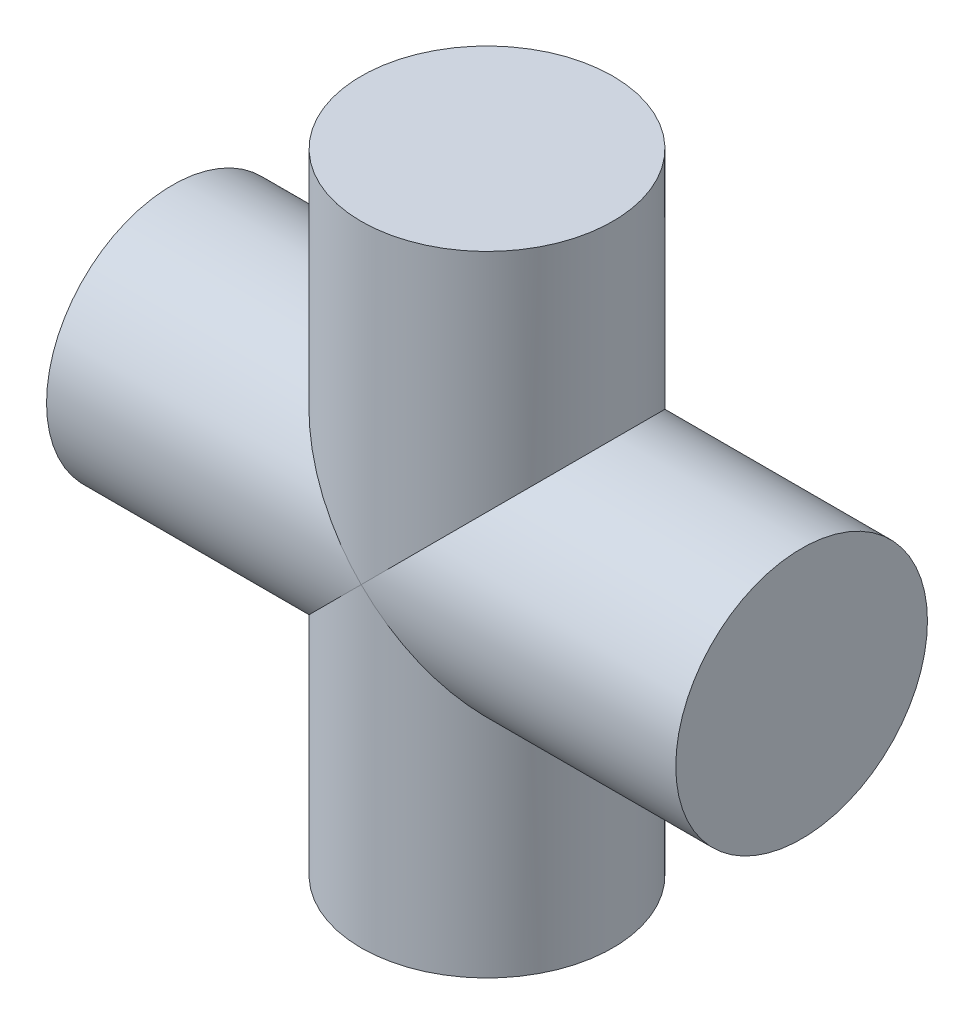
from build123d import *

# Parameters (mm, degrees)
BOSS_EXTRUDE1_DEPTH      = 20
BOSS_EXTRUDE1_DEPTH_BACK = 20
SKETCH1_R                = 8
BOSS_EXTRUDE2_DEPTH      = 20
BOSS_EXTRUDE2_DEPTH_BACK = 20
SKETCH3_R                = 8


with BuildPart() as part:
    # Sketch1 → Boss-Extrude1 (new, two sides: drawn at the far end of the back side and taken through both)
    with BuildSketch(Plane(origin=(0, 0, 0), x_dir=(1, 0, 0), z_dir=(0, 1, 0)).offset(-BOSS_EXTRUDE1_DEPTH_BACK)):
        Circle(SKETCH1_R)
    extrude(amount=BOSS_EXTRUDE1_DEPTH + BOSS_EXTRUDE1_DEPTH_BACK)

    # Sketch3 → Boss-Extrude2 (add, two sides: drawn at the far end of the back side and taken through both)
    with BuildSketch(Plane(origin=(0, 0, 0), x_dir=(0, 0, -1), z_dir=(1, 0, 0)).offset(-BOSS_EXTRUDE2_DEPTH_BACK)):
        Circle(SKETCH3_R)
    extrude(amount=BOSS_EXTRUDE2_DEPTH + BOSS_EXTRUDE2_DEPTH_BACK)


solid = part.part
